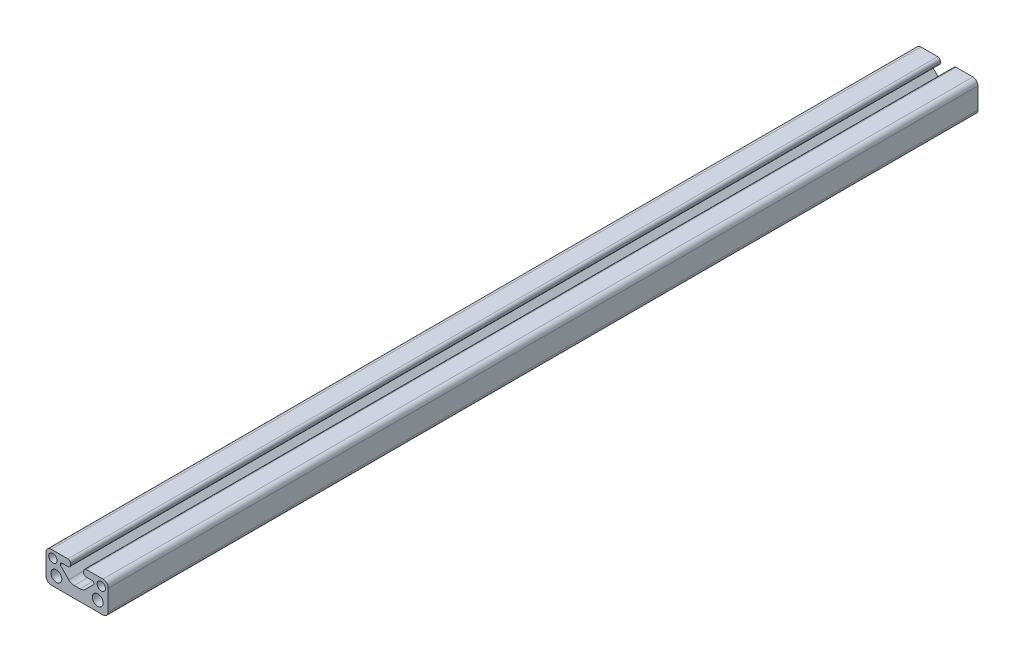
from build123d import *

# Parameters (mm, degrees)
SKETCH1_R           = 2.5527
SKETCH1_R_2         = 3.3274
BOSS_EXTRUDE1_DEPTH = 533.4


with BuildPart() as part:
    # Sketch1 → Boss-Extrude1 (new body)
    with BuildSketch(Plane(origin=(0, 0, -533.4), x_dir=(-1, 0, 0), z_dir=(0, 0, -1))):
        with BuildLine():
            Line((19.05, 3.175), (19.05, 15.875))
            ThreePointArc((19.05, 15.875), (18.12006403, 18.12006403), (15.875, 19.05))
            Line((15.875, 19.05), (5.6388, 19.05))
            ThreePointArc((5.6388, 19.05), (4.525248241, 18.588751759), (4.064, 17.4752))
            Line((4.064, 17.4752), (4.064, 16.5608))
            ThreePointArc((4.064, 16.5608), (4.525248241, 15.447248241), (5.6388, 14.986))
            Line((5.6388, 14.986), (9.398, 14.986))
            ThreePointArc((9.398, 14.986), (10.026617928, 14.725617928), (10.287, 14.097))
            Line((10.287, 14.097), (10.287, 13.779435857))
            ThreePointArc((10.287, 13.779435857), (10.219328904, 13.439230286), (10.026617928, 13.150817928))
            Line((10.026617928, 13.150817928), (5.124984211, 8.249184211))
            ThreePointArc((5.124984211, 8.249184211), (3.584038188, 7.219556996), (1.766368421, 6.858))
            Line((1.766368421, 6.858), (-1.766368421, 6.858))
            ThreePointArc((-1.766368421, 6.858), (-3.584038188, 7.219556996), (-5.124984211, 8.249184211))
            Line((-5.124984211, 8.249184211), (-10.026617928, 13.150817928))
            ThreePointArc((-10.026617928, 13.150817928), (-10.219328904, 13.439230286), (-10.287, 13.779435857))
            Line((-10.287, 13.779435857), (-10.287, 14.097))
            ThreePointArc((-10.287, 14.097), (-10.026617928, 14.725617928), (-9.398, 14.986))
            Line((-9.398, 14.986), (-5.6388, 14.986))
            ThreePointArc((-5.6388, 14.986), (-4.525248241, 15.447248241), (-4.064, 16.5608))
            Line((-4.064, 16.5608), (-4.064, 17.4752))
            ThreePointArc((-4.064, 17.4752), (-4.525248241, 18.588751759), (-5.6388, 19.05))
            Line((-5.6388, 19.05), (-15.875, 19.05))
            ThreePointArc((-15.875, 19.05), (-18.12006403, 18.12006403), (-19.05, 15.875))
            Line((-19.05, 15.875), (-19.05, 3.175))
            ThreePointArc((-19.05, 3.175), (-18.12006403, 0.92993597), (-15.875, 0))
            Line((-15.875, 0), (15.875, 0))
            ThreePointArc((15.875, 0), (18.12006403, 0.92993597), (19.05, 3.175))
        make_face()
        with Locations(Location((14.848797074, 14.801432678, 0), (0, 0, 180))):
            Circle(SKETCH1_R, mode=Mode.SUBTRACT)
        with Locations(Location((12.7, 6.35, 0), (0, 0, 180))):
            Circle(SKETCH1_R_2, mode=Mode.SUBTRACT)
        with Locations(Location((-12.7, 6.35, 0), (0, 0, 180))):
            Circle(SKETCH1_R_2, mode=Mode.SUBTRACT)
        with Locations(Location((-14.848797074, 14.801432678, 0), (0, 0, 180))):
            Circle(SKETCH1_R, mode=Mode.SUBTRACT)
    extrude(amount=-BOSS_EXTRUDE1_DEPTH)


solid = part.part
